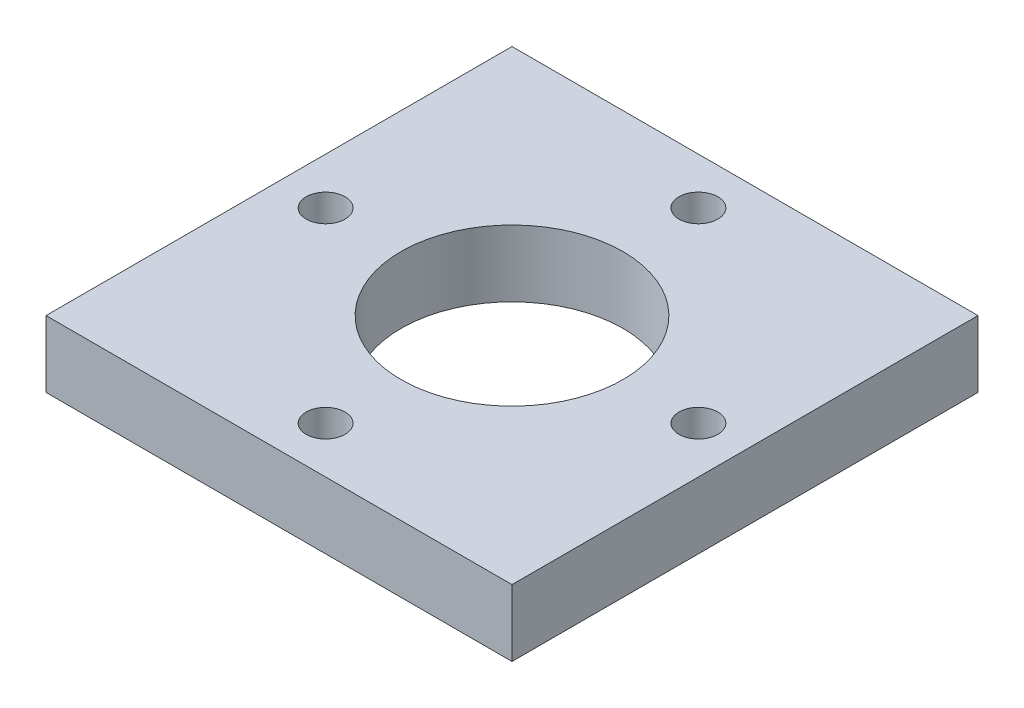
from build123d import *

# Parameters (mm, degrees)
SKETCH1_W           = 66.675
SKETCH1_H           = 66.675
SKETCH1_R           = 15.875
SKETCH1_R_2         = 2.77876
BOSS_EXTRUDE1_DEPTH = 9.525


with BuildPart() as part:
    # Sketch1 → Boss-Extrude1 (new body)
    with BuildSketch(Plane(origin=(0, 0, 0), x_dir=(1, 0, 0), z_dir=(0, 1, 0))):
        Rectangle(SKETCH1_W, SKETCH1_H)
        with Locations(Location((0, 0, 0), (0, 0, 90))):
            Circle(SKETCH1_R, mode=Mode.SUBTRACT)
        with Locations(Location((0, 26.67, 0), (0, 0, 90))):
            Circle(SKETCH1_R_2, mode=Mode.SUBTRACT)
        with Locations(Location((26.67, 0, 0), (0, 0, 90))):
            Circle(SKETCH1_R_2, mode=Mode.SUBTRACT)
        with Locations(Location((0, -26.67, 0), (0, 0, 90))):
            Circle(SKETCH1_R_2, mode=Mode.SUBTRACT)
        with Locations(Location((-26.67, 0, 0), (0, 0, 90))):
            Circle(SKETCH1_R_2, mode=Mode.SUBTRACT)
    extrude(amount=BOSS_EXTRUDE1_DEPTH)


solid = part.part
